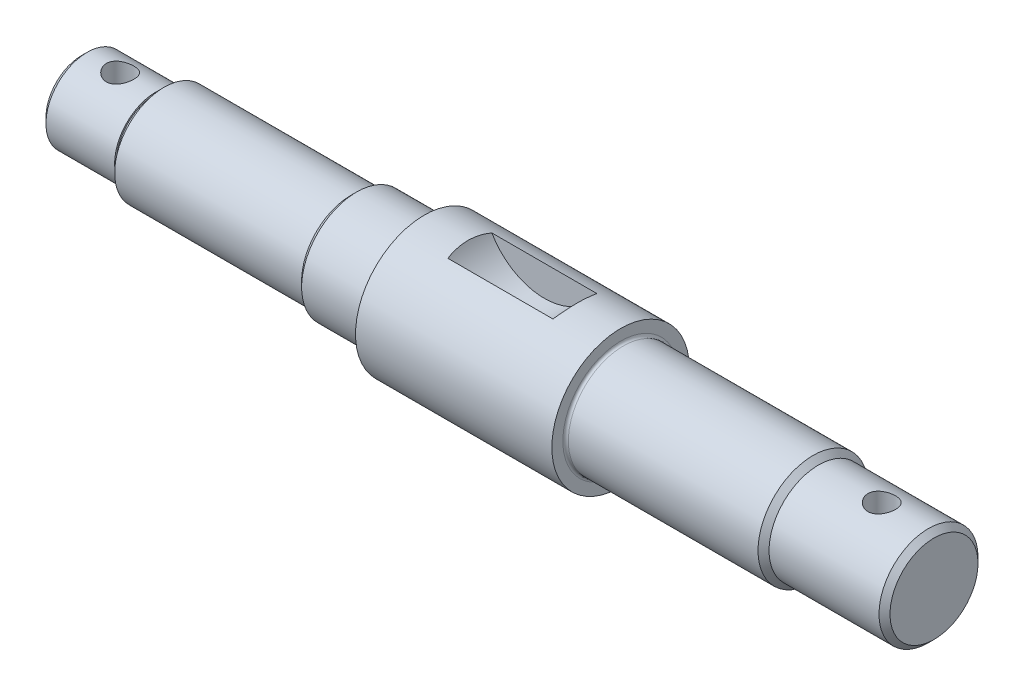
from build123d import *

# Parameters (mm, degrees)
CHAMFER1_SIZE           = 1
SKETCH2_R               = 11
CUT_EXTRUDE1_DEPTH      = 4
CUT_EXTRUDE2_DEPTH      = 157.004807634
CUT_EXTRUDE2_DEPTH_BACK = 157.004807634
SKETCH3_R               = 2.5


with BuildPart() as part:
    # Sketch1 → Revolve1 (revolve)
    with BuildSketch(Plane.XY, mode=Mode.PRIVATE) as revolve1_sk:
        with BuildLine():
            Line((0, 0), (0, 6.5))
            Line((0, 6.5), (1, 7.5))
            Line((1, 7.5), (13.5, 7.5))
            Line((13.5, 7.5), (13.5, 7.2))
            Line((13.5, 7.2), (15, 7.2))
            Line((15, 7.2), (15, 9))
            Line((15, 9), (49, 9))
            Line((49, 9), (50, 10))
            Line((50, 10), (61.8, 10))
            ThreePointArc((61.8, 10), (62.153553391, 10.146446609), (62.3, 10.5))
            Line((62.3, 10.5), (62.3, 12.5))
            Line((62.3, 12.5), (98, 12.5))
            Line((98, 12.5), (98, 10.5))
            ThreePointArc((98, 10.5), (98.146446609, 10.146446609), (98.5, 10))
            Line((98.5, 10), (133, 10))
            Line((133, 10), (134, 9))
            Line((134, 9), (155, 9))
            Line((155, 9), (155, 0))
            Line((155, 0), (0, 0))
        make_face()
    revolve(revolve1_sk.sketch.rotate(Axis((155, 0, 0), (-1, 0, 0)), 90), axis=Axis((155, 0, 0), (-1, 0, 0)))

    # Chamfer1
    chamfer1_edges = [part.edges().sort_by_distance(p)[0] for p in [
        (155, 0, 9),
    ]]
    chamfer(chamfer1_edges, length=CHAMFER1_SIZE)

    # Sketch2 → Cut-Extrude1 (cut, symmetric)
    with BuildSketch(Plane.XY):
        with Locations((80.15, 17.3)):
            Circle(SKETCH2_R)
    extrude(amount=CUT_EXTRUDE1_DEPTH, both=True, mode=Mode.SUBTRACT)

    # Sketch3 → Cut-Extrude2 (cut, two sides: drawn at the far end of the back side and taken through both)
    with BuildSketch(Plane(origin=(0, 0, 0), x_dir=(1, 0, 0), z_dir=(0, 1, 0)).offset(-CUT_EXTRUDE2_DEPTH_BACK)):
        with Locations(Location((7, 0, 0), (0, 0, 270))):
            Circle(SKETCH3_R)
        with Locations(Location((145.5, 0, 0), (0, 0, 270))):
            Circle(SKETCH3_R)
    extrude(amount=CUT_EXTRUDE2_DEPTH + CUT_EXTRUDE2_DEPTH_BACK, mode=Mode.SUBTRACT)


solid = part.part
